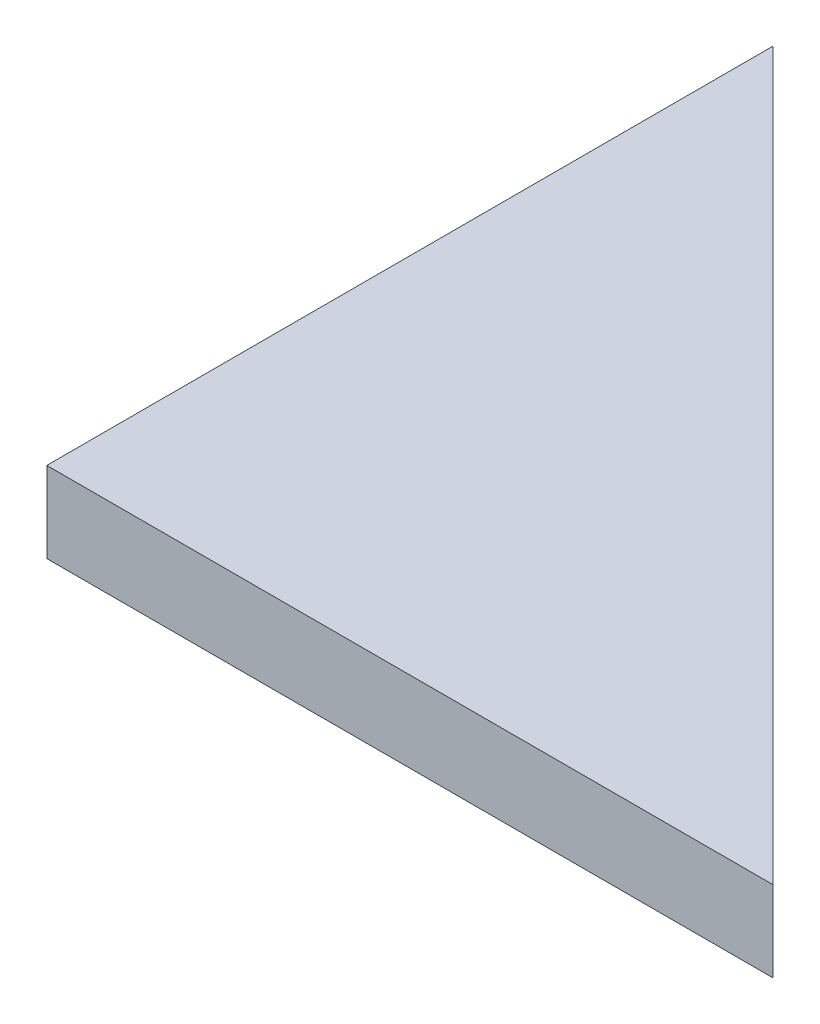
from build123d import *

# Parameters (mm, degrees)
GUSSET_DEPTH = 3.175


with BuildPart() as part:
    # Sketch1 → Gusset (new, symmetric)
    with BuildSketch(Plane(origin=(0, 0, 0), x_dir=(1, 0, 0), z_dir=(0, 1, 0))):
        Polygon((0, 0), (57.15, 0), (0, 57.15), align=None)
    extrude(amount=GUSSET_DEPTH, both=True)


solid = part.part
